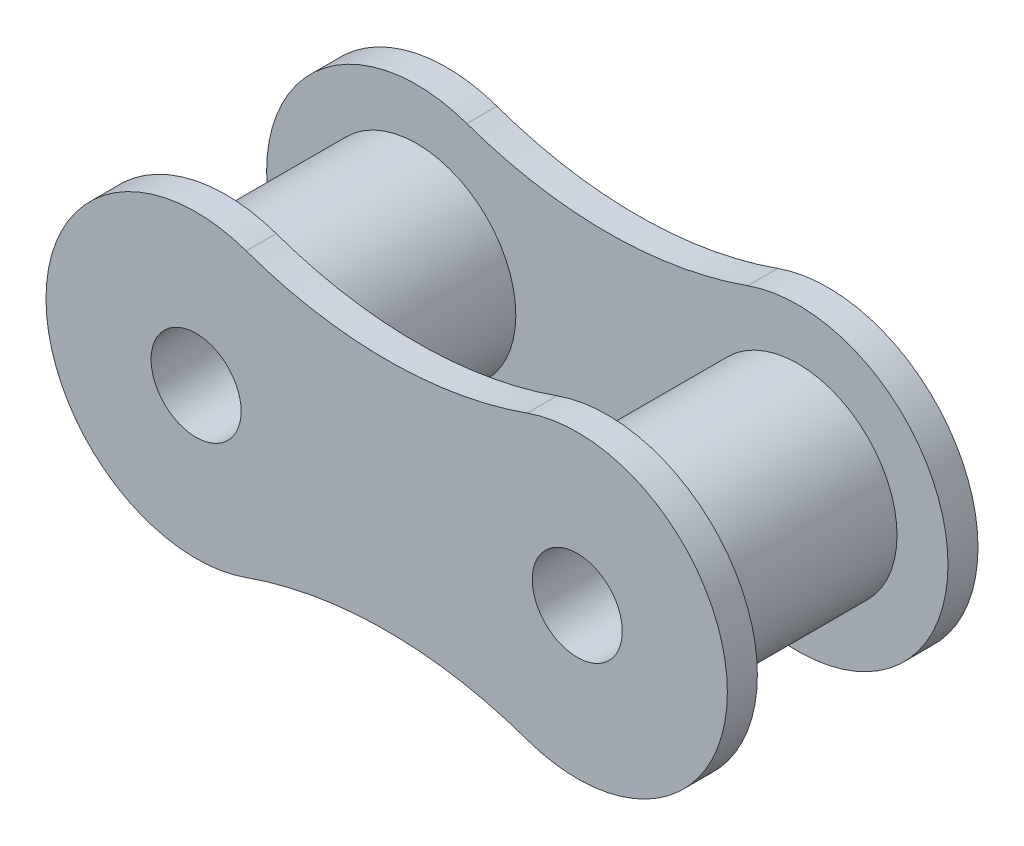
from build123d import *

# Parameters (mm, degrees)
SKETCH1_R           = 0.75
BOSS_EXTRUDE1_DEPTH = 0.5
SKETCH2_R           = 1.651
SKETCH2_R_2         = 0.75
BOSS_EXTRUDE2_DEPTH = 3.175


with BuildPart() as part:
    # Sketch1 → Boss-Extrude1 (new body)
    with BuildSketch(Plane.XY):
        with BuildLine():
            ThreePointArc((0.835526316, 2.356246119), (-2.5, 0), (0.835526316, -2.356246119))
            ThreePointArc((0.835526316, -2.356246119), (3.175, -1.953735254), (5.514473684, -2.356246119))
            ThreePointArc((5.514473684, -2.356246119), (8.85, 0), (5.514473684, 2.356246119))
            ThreePointArc((5.514473684, 2.356246119), (3.175, 1.953735254), (0.835526316, 2.356246119))
        make_face()
        Circle(SKETCH1_R, mode=Mode.SUBTRACT)
        with Locations(Location((6.35, 0, 0), (0, 0, 180))):
            Circle(SKETCH1_R, mode=Mode.SUBTRACT)
    extrude(amount=BOSS_EXTRUDE1_DEPTH)

    # Sketch2 → Boss-Extrude2 (add)
    # profile 1 of 2: a face of its own
    with BuildSketch(Plane.XY.offset(0.5)):
        with Locations((6.35, 0)):
            Circle(SKETCH2_R)
        with Locations(Location((6.35, 0, 0), (0, 0, 180))):
            Circle(SKETCH2_R_2, mode=Mode.SUBTRACT)
    # profile 2 of 2: a face of its own
    with BuildSketch(Plane.XY.offset(0.5)):
        Circle(SKETCH2_R)
        Circle(SKETCH2_R_2, mode=Mode.SUBTRACT)
    extrude(amount=BOSS_EXTRUDE2_DEPTH)

    # Mirror1: part across plane


with BuildPart() as part_1:
    add(part.part)
    add(part.part.mirror(Plane.XY.offset(2.0875)))


solid = part_1.part
